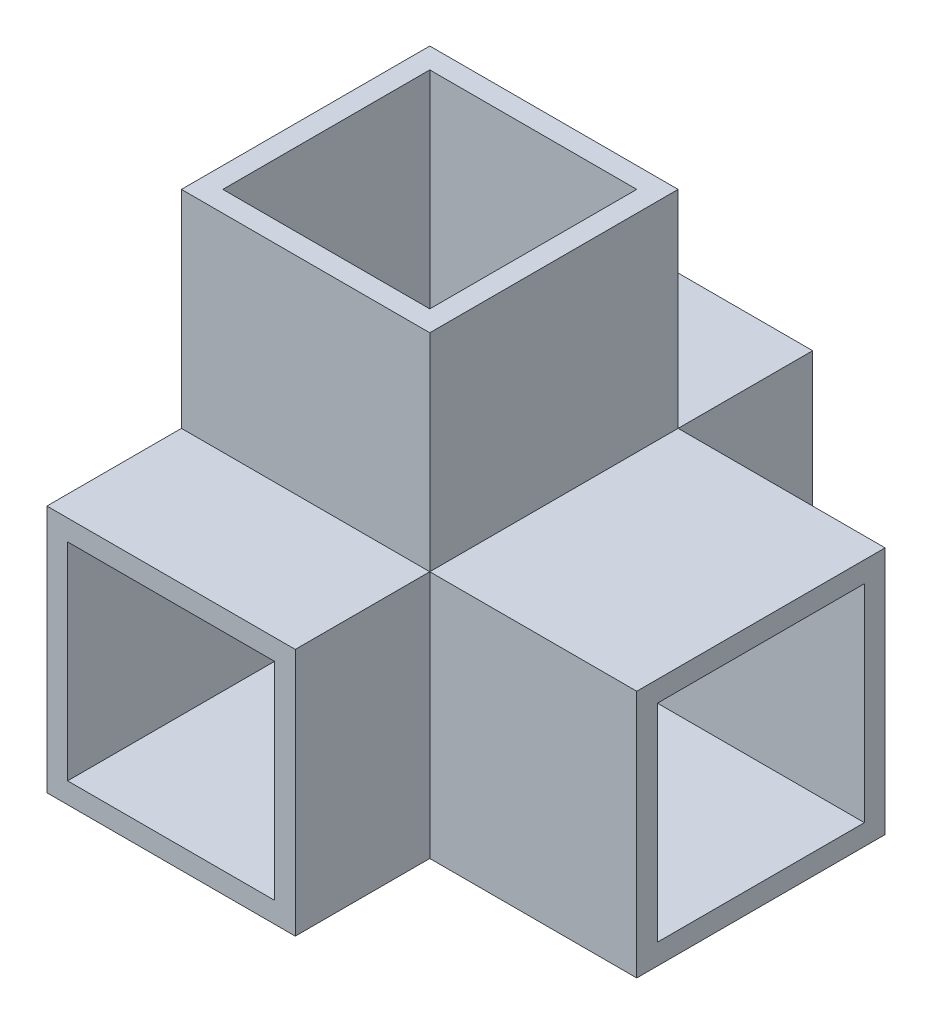
from build123d import *

# Parameters (mm, degrees)
SKETCH_2_W      = 48
SKETCH_2_H      = 48
SKETCH_2_W_2    = 40
SKETCH_2_H_2    = 40
EXTRUDE_1_DEPTH = 100
SKETCH_3_W      = 48
SKETCH_3_H      = 48
SKETCH_3_W_2    = 40
SKETCH_3_H_2    = 40
EXTRUDE_2_DEPTH = 40
SKETCH_4_W      = 48
SKETCH_4_H      = 48
SKETCH_4_W_2    = 40
SKETCH_4_H_2    = 40
EXTRUDE_3_DEPTH = 40


with BuildPart() as part:
    # 草图2 → 凸台-拉伸1 (new body)
    with BuildSketch(Plane.XY):
        Rectangle(SKETCH_2_W, SKETCH_2_H)
        Rectangle(SKETCH_2_W_2, SKETCH_2_H_2, mode=Mode.SUBTRACT)
    extrude(amount=EXTRUDE_1_DEPTH)

    # 草图3 → 凸台-拉伸2 (add)
    with BuildSketch(Plane(origin=(24, 0, 0), x_dir=(0, 0, -1), z_dir=(1, 0, 0))):
        with Locations((-50, 0)):
            Rectangle(SKETCH_3_W, SKETCH_3_H)
        with Locations((-50, 0)):
            Rectangle(SKETCH_3_W_2, SKETCH_3_H_2, mode=Mode.SUBTRACT)
    extrude(amount=EXTRUDE_2_DEPTH)

    # 草图4 → 凸台-拉伸3 (add)
    with BuildSketch(Plane(origin=(0, 24, 0), x_dir=(1, 0, 0), z_dir=(0, 1, 0))):
        with Locations((0, -50)):
            Rectangle(SKETCH_4_W, SKETCH_4_H)
        with Locations((0, -50)):
            Rectangle(SKETCH_4_W_2, SKETCH_4_H_2, mode=Mode.SUBTRACT)
    extrude(amount=EXTRUDE_3_DEPTH)


solid = part.part
